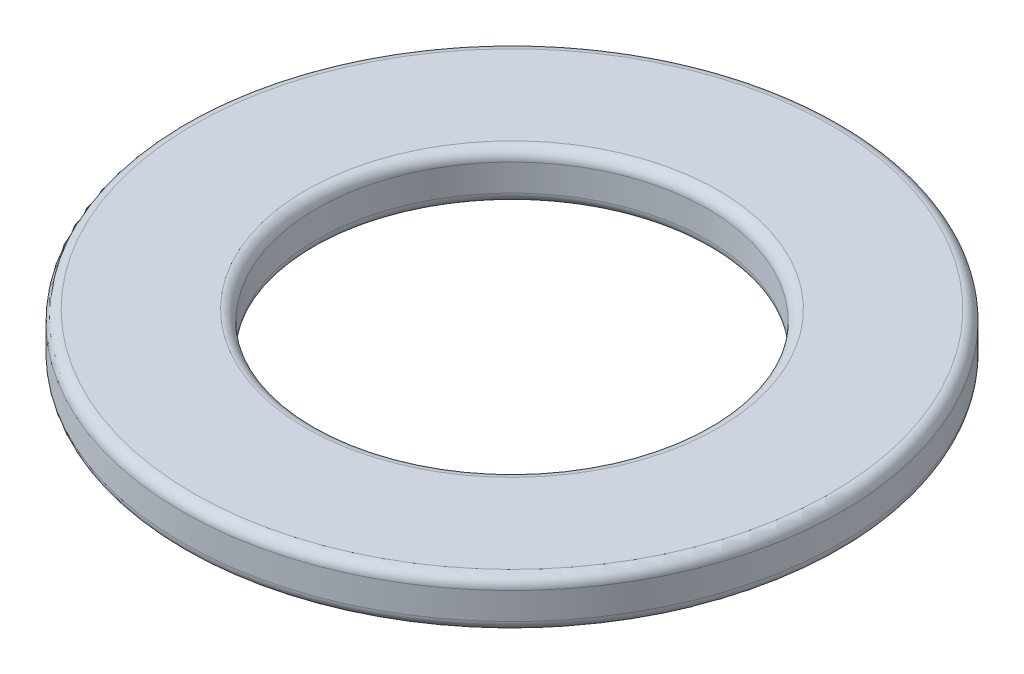
from build123d import *

# Parameters (mm, degrees)
SKETCH_1_R      = 30.7
SKETCH_1_R_2    = 18.2
EXTRUDE_1_DEPTH = 4.5
FILLET_1_R      = 1


with BuildPart() as part:
    # Эскиз1 → Вытянуть1 (new body)
    with BuildSketch(Plane(origin=(0, 0, 0), x_dir=(1, 0, 0), z_dir=(0, 1, 0))):
        with Locations(Location((0, 0, 0), (0, 0, 270))):
            Circle(SKETCH_1_R)
        with Locations(Location((0, 0, 0), (0, 0, 270))):
            Circle(SKETCH_1_R_2, mode=Mode.SUBTRACT)
    extrude(amount=EXTRUDE_1_DEPTH)

    # Скругление1
    fillet_1_edges = [part.edges().sort_by_distance(p)[0] for p in [
        (0, 0, -30.7),
        (0, 4.5, -30.7),
        (0, 0, -18.2),
        (0, 4.5, -18.2),
    ]]
    fillet(fillet_1_edges, radius=FILLET_1_R)


solid = part.part
